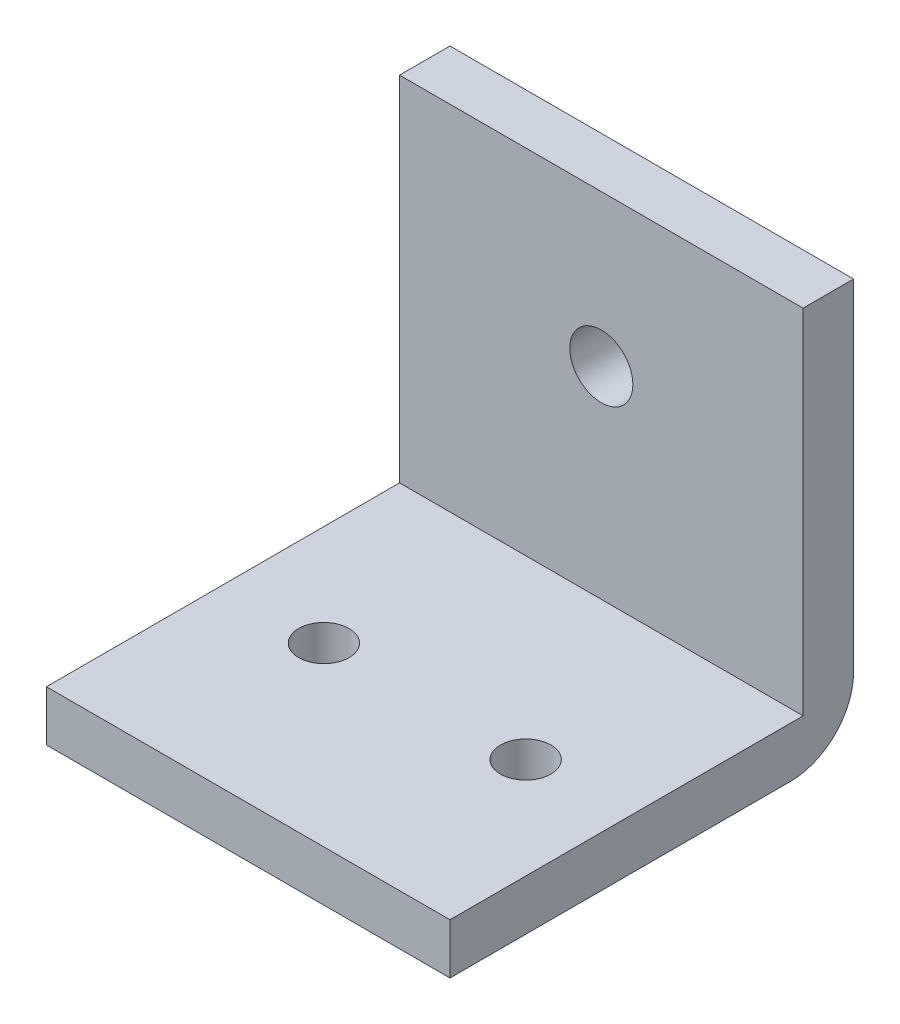
from build123d import *

# Parameters (mm, degrees)
SKETCH1_W           = 40
SKETCH1_H           = 35
SKETCH1_R           = 3.125
BOSS_EXTRUDE1_DEPTH = 5
SKETCH1_3_W         = 40
SKETCH1_3_H         = 5
BOSS_EXTRUDE2_DEPTH = 40
FILLET1_R           = 6.25
SKETCH2_R           = 2.5
CUT_EXTRUDE1_DEPTH  = 67.520673478


with BuildPart() as part:
    # Sketch1 → Boss-Extrude1 (new body)
    with BuildSketch(Plane.XY):
        with Locations((20, 22.5)):
            Rectangle(SKETCH1_W, SKETCH1_H)
        with Locations((20, 25)):
            Circle(SKETCH1_R, mode=Mode.SUBTRACT)
    extrude(amount=BOSS_EXTRUDE1_DEPTH)

    # Sketch1<3> → Boss-Extrude2 (add)
    with BuildSketch(Plane.XY):
        with Locations((20, 2.5)):
            Rectangle(SKETCH1_3_W, SKETCH1_3_H)
    extrude(amount=BOSS_EXTRUDE2_DEPTH)

    # Fillet1
    fillet1_edges = [part.edges().sort_by_distance(p)[0] for p in [
        (20, 0, 0),
    ]]
    fillet(fillet1_edges, radius=FILLET1_R)

    # Sketch2 → Cut-Extrude1 (cut, through all)
    with BuildSketch(Plane(origin=(0, 5, 0), x_dir=(1, 0, 0), z_dir=(0, 1, 0))):
        with Locations((10, -22.5)):
            Circle(SKETCH2_R)
        with Locations((30, -22.5)):
            Circle(SKETCH2_R)
    extrude(amount=-CUT_EXTRUDE1_DEPTH, mode=Mode.SUBTRACT)


solid = part.part
